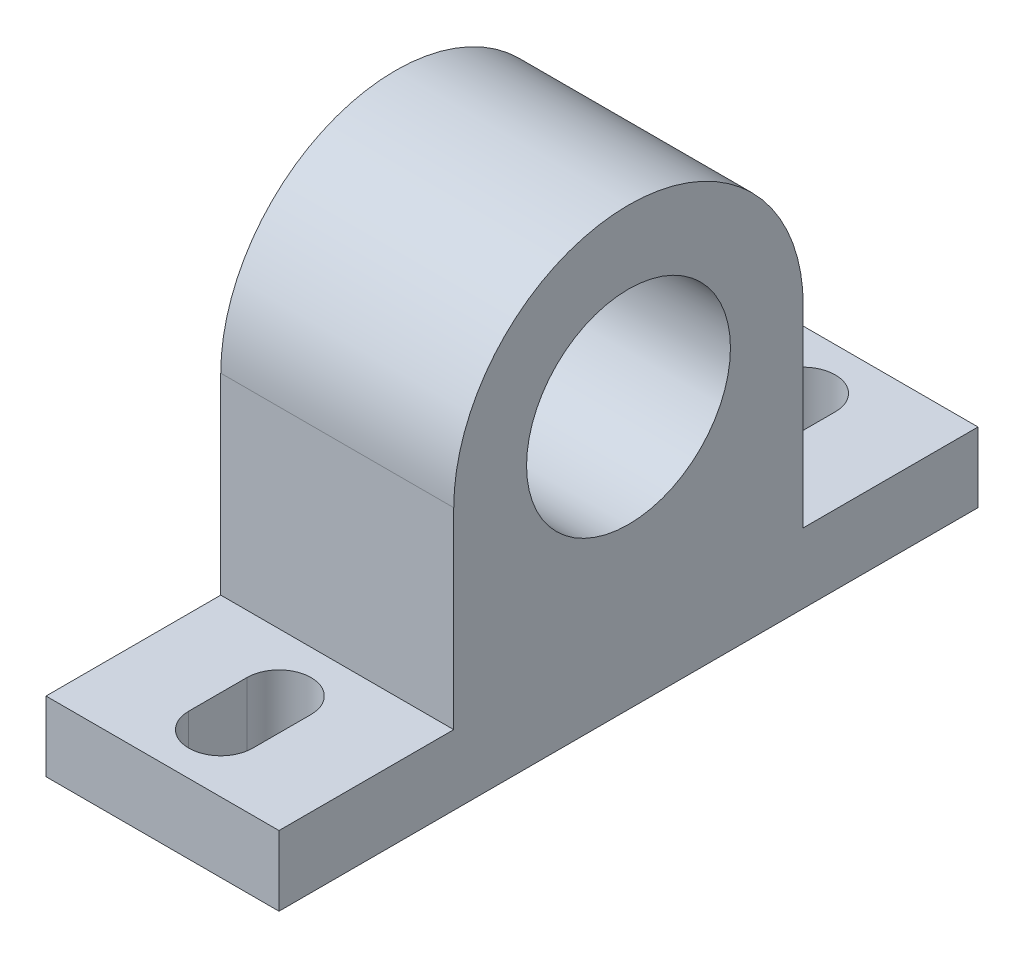
from build123d import *

# Parameters (mm, degrees)
SKETCH_1_W          = 40
SKETCH_1_H          = 120
EXTRUDE_1_DEPTH     = 12
EXTRUDE_2_DEPTH     = 40
SKETCH_3_R          = 17.5
CUT_EXTRUDE_1_DEPTH = 121
CUT_EXTRUDE_2_DEPTH = 90.269255626


with BuildPart() as part:
    # 草图1 → 凸台-拉伸1 (new body)
    with BuildSketch(Plane(origin=(0, 0, 0), x_dir=(1, 0, 0), z_dir=(0, 1, 0))):
        Rectangle(SKETCH_1_W, SKETCH_1_H)
    extrude(amount=EXTRUDE_1_DEPTH)

    # 草图2 → 凸台-拉伸2 (add)
    with BuildSketch(Plane(origin=(-20, 0, 0), x_dir=(0, 0, -1), z_dir=(1, 0, 0))):
        with BuildLine():
            Line((30, 10), (30, 45))
            ThreePointArc((30, 45), (0, 75), (-30, 45))
            Line((-30, 45), (-30, 10))
            Line((-30, 10), (30, 10))
        make_face()
    extrude(amount=EXTRUDE_2_DEPTH)

    # 草图3 → 切除-拉伸1 (cut, symmetric)
    with BuildSketch(Plane(origin=(0, 0, 0), x_dir=(0, 0, -1), z_dir=(1, 0, 0))):
        with Locations((0, 45)):
            Circle(SKETCH_3_R)
    extrude(amount=CUT_EXTRUDE_1_DEPTH, both=True, mode=Mode.SUBTRACT)

    # 草图4 → 切除-拉伸2 (cut, through all)
    with BuildSketch(Plane(origin=(0, 12, 0), x_dir=(1, 0, 0), z_dir=(0, 1, 0))):
        with BuildLine():
            Line((5.5, -40), (5.5, -50))
            ThreePointArc((5.5, -50), (0, -55.5), (-5.5, -50))
            Line((-5.5, -50), (-5.5, -40))
            ThreePointArc((-5.5, -40), (0, -34.5), (5.5, -40))
        make_face()
        with BuildLine():
            Line((5.5, 50), (5.5, 40))
            ThreePointArc((5.5, 40), (0, 34.5), (-5.5, 40))
            Line((-5.5, 40), (-5.5, 50))
            ThreePointArc((-5.5, 50), (0, 55.5), (5.5, 50))
        make_face()
    extrude(amount=-CUT_EXTRUDE_2_DEPTH, mode=Mode.SUBTRACT)


solid = part.part
